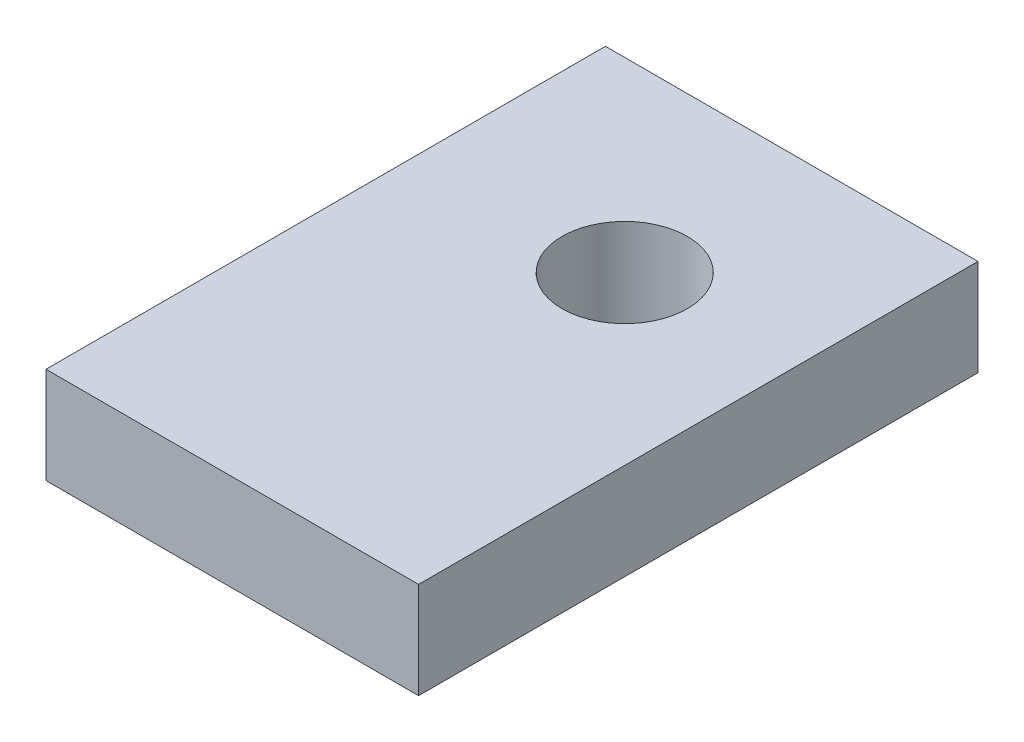
from build123d import *

# Parameters (mm, degrees)
SKETCH3_W           = 24.539999942
SKETCH3_H           = 36.845
SKETCH3_R           = 4.127
BOSS_EXTRUDE1_DEPTH = 6.35


with BuildPart() as part:
    # Sketch3 → Boss-Extrude1 (new body)
    with BuildSketch(Plane(origin=(0, 0, 0), x_dir=(1, 0, 0), z_dir=(0, 1, 0))):
        with Locations((12.269999971, -18.4225)):
            Rectangle(SKETCH3_W, SKETCH3_H)
        with Locations(Location((13.54, -12.27, 0), (0, 0, 270))):
            Circle(SKETCH3_R, mode=Mode.SUBTRACT)
    extrude(amount=BOSS_EXTRUDE1_DEPTH)


solid = part.part
